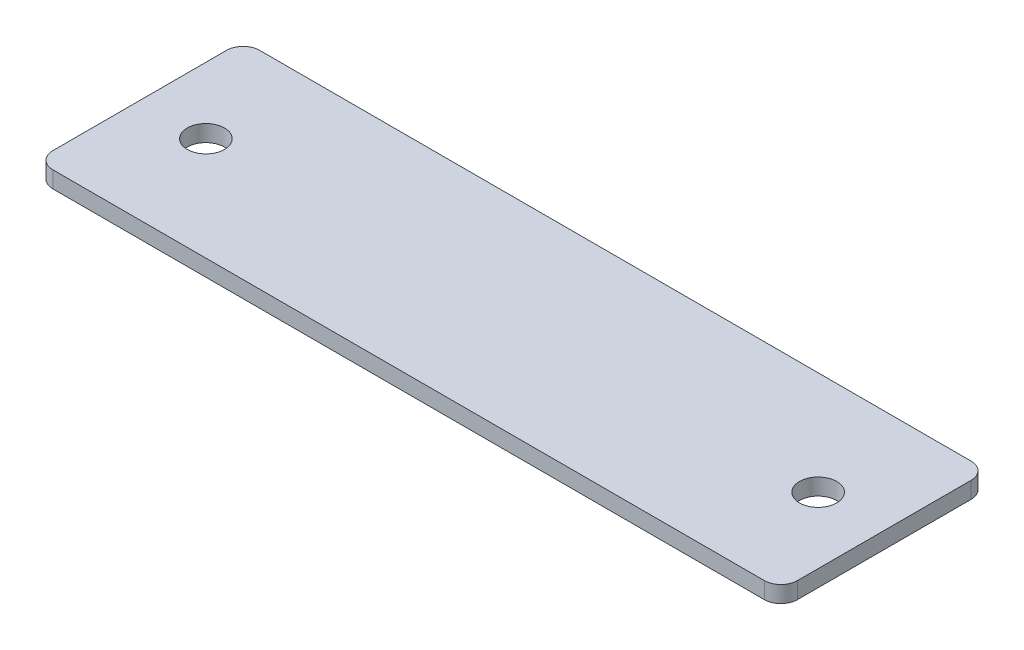
from build123d import *

# Parameters (mm, degrees)
ESQUISSE1_W             = 90
ESQUISSE1_H             = 2
EXTRU_MINCE1_DEPTH      = 25
CONG_1_R                = 2
CONG_2_R                = 2
CONG_3_R                = 2
CONG_4_R                = 2
ESQUISSE2_R             = 2.25
ENL_V_MAT_EXTRU_1_DEPTH = 10


with BuildPart() as part:
    # Esquisse1 → Extru.-Mince1 (new body)
    with BuildSketch(Plane.XY):
        with Locations((45, -1)):
            Rectangle(ESQUISSE1_W, ESQUISSE1_H)
    extrude(amount=EXTRU_MINCE1_DEPTH)

    # Congé1
    cong_1_edges = [part.edges().sort_by_distance(p)[0] for p in [
        (90, -1, 25),
    ]]
    fillet(cong_1_edges, radius=CONG_1_R)

    # Congé2
    cong_2_edges = [part.edges().sort_by_distance(p)[0] for p in [
        (90, -1, 0),
    ]]
    fillet(cong_2_edges, radius=CONG_2_R)

    # Congé3
    cong_3_edges = [part.edges().sort_by_distance(p)[0] for p in [
        (0, -1, 0),
    ]]
    fillet(cong_3_edges, radius=CONG_3_R)

    # Congé4
    cong_4_edges = [part.edges().sort_by_distance(p)[0] for p in [
        (0, -1, 25),
    ]]
    fillet(cong_4_edges, radius=CONG_4_R)

    # Esquisse2 → Enlèv. mat.-Extru.1 (cut)
    with BuildSketch(Plane(origin=(0, 0, 0), x_dir=(1, 0, 0), z_dir=(0, 1, 0))):
        with Locations(Location((82, -12.5, 0), (0, 0, 270))):
            Circle(ESQUISSE2_R)
        with Locations(Location((8, -12.5, 0), (0, 0, 270))):
            Circle(ESQUISSE2_R)
    extrude(amount=-ENL_V_MAT_EXTRU_1_DEPTH, mode=Mode.SUBTRACT)


solid = part.part
